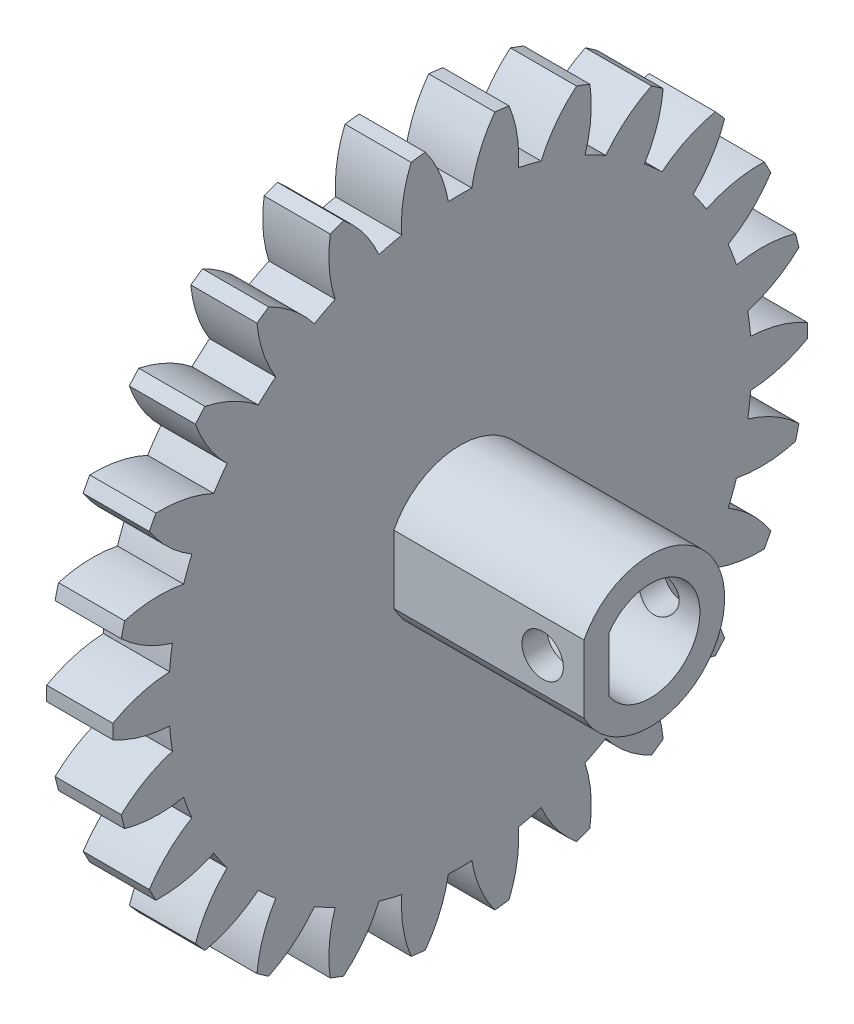
from build123d import *

# Parameters (mm, degrees)
BASPROSKE_W         = 4
BASPROSKE_H         = 21
TOOTHCUT_DEPTH      = 30.966648128
TEETHCUTS_COUNT     = 26
TEETHCUTS_ANGLE     = 346.153846154
BORSKE_R            = 3
BORE_DEPTH          = 50.0000508
EXTRUDE_START       = 11.5
EXTRUDE_1_DEPTH     = 11.5
SKETCH_2_R          = 1.25
CUT_EXTRUDE_1_DEPTH = 37.084686733


with BuildPart() as part:
    # BasProSke → Base-Revolve (revolve)
    with BuildSketch(Plane(origin=(0, 0, 0), x_dir=(1, 0, 0), z_dir=(0, 1, 0)), mode=Mode.PRIVATE) as base_revolve_sk:
        with Locations((2, 10.5)):
            Rectangle(BASPROSKE_W, BASPROSKE_H)
    revolve(base_revolve_sk.sketch.rotate(Axis((-10, 0, 0), (1, 0, 0)), 180), axis=Axis((-10, 0, 0), (1, 0, 0)))

    # TooCutSke → ToothCut (cut, through all)
    with BuildSketch(Plane(origin=(0, 0, 0), x_dir=(0, 0, -1), z_dir=(1, 0, 0))):
        with BuildLine():
            ThreePointArc((0.70920213, 17.609724823), (0, 17.624), (-0.70920213, 17.609724823))
            ThreePointArc((-0.70920213, 17.609724823), (-1.221230171, 19.346413175), (-2.119872395, 20.918259636))
            ThreePointArc((-2.119872395, 20.918259636), (0, 21.0254), (2.119872395, 20.918259636))
            ThreePointArc((2.119872395, 20.918259636), (1.221230171, 19.346413175), (0.70920213, 17.609724823))
        make_face()
    toothcut = extrude(amount=TOOTHCUT_DEPTH, mode=Mode.SUBTRACT)

    # TeethCuts: ToothCut ×26 about axis
    teethcuts_axis = Axis((-10, 0, 0), (1, 0, 0))
    for i in range(1, TEETHCUTS_COUNT):
        add(toothcut.rotate(teethcuts_axis, i * TEETHCUTS_ANGLE / (TEETHCUTS_COUNT - 1)), mode=Mode.SUBTRACT)

    # BorSke → Bore (cut, symmetric)
    with BuildSketch(Plane(origin=(0, 0, 0), x_dir=(0, 0, -1), z_dir=(1, 0, 0))):
        with Locations(Location((0, 0, 0), (0, 0, 180))):
            Circle(BORSKE_R)
    extrude(amount=BORE_DEPTH, both=True, mode=Mode.SUBTRACT)

    # 草图1 → 凸台-拉伸1 (add)
    with BuildSketch(Plane(origin=(4, 0, 0), x_dir=(0, 0, -1), z_dir=(1, 0, 0)).offset(EXTRUDE_START)):
        with BuildLine():
            Line((-4.005493963, 2.050857896), (-4.005493963, -2.050857896))
            ThreePointArc((-4.005493963, -2.050857896), (4.5, 0), (-4.005493963, 2.050857896))
        make_face()
        with BuildLine():
            Line((-2.505493963, 1.65), (-2.505493963, -1.65))
            ThreePointArc((-2.505493963, -1.65), (3, 0), (-2.505493963, 1.65))
        make_face(mode=Mode.SUBTRACT)
    extrude(amount=-EXTRUDE_1_DEPTH)

    # 草图2 → 切除-拉伸1 (cut, through all)
    with BuildSketch(Plane.XY.offset(4.005493963)):
        with Locations((13, 0)):
            Circle(SKETCH_2_R)
    extrude(amount=-CUT_EXTRUDE_1_DEPTH, mode=Mode.SUBTRACT)


solid = part.part
